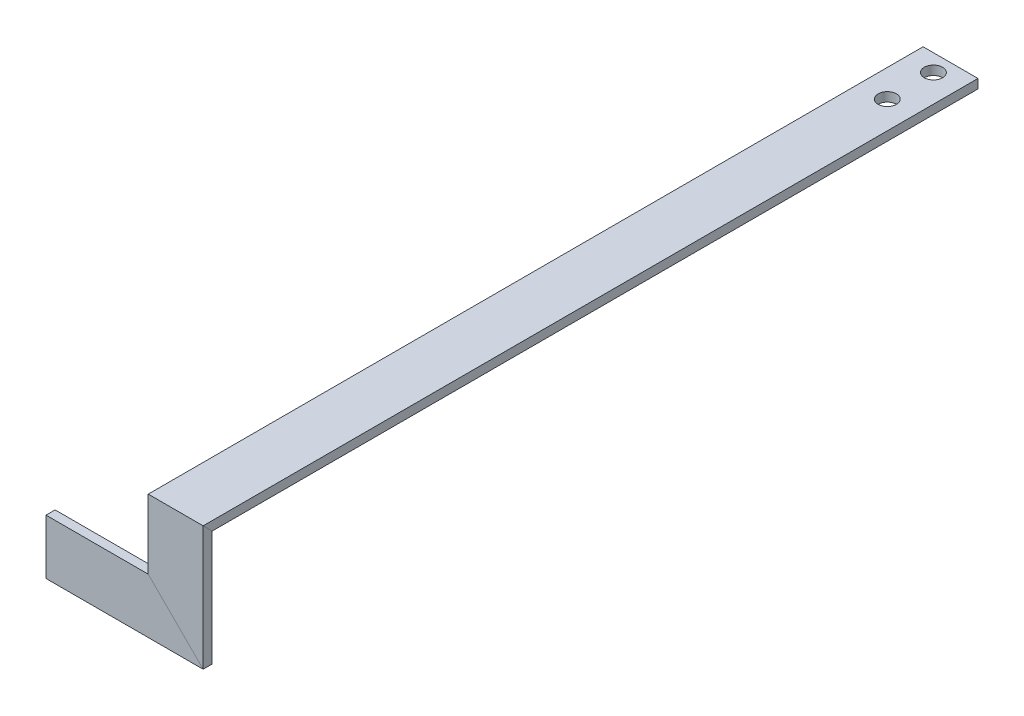
from build123d import *

# Parameters (mm, degrees)
CROQUIS1_W            = 38.1
CROQUIS1_H            = 6.31
CROQUIS2_R            = 6.35
CORTAR_EXTRUIR1_DEPTH = 6.31


with BuildPart() as part:
    # Barrer1: sweep along a curve in space
    with BuildLine() as barrer1_path:
        Line((0, 0, 0), (0, 0, 534.55))
        Line((0, 0, 534.55), (0, -64, 534.55))
        Line((0, -64, 534.55), (-90, -64, 534.55))
    # Croquis1 → Barrer1 (sweep)
    with BuildSketch(Plane.XY):
        Rectangle(CROQUIS1_W, CROQUIS1_H)
    sweep(path=barrer1_path.line, transition=Transition.RIGHT)

    # Croquis2 → Cortar-Extruir1 (cut)
    with BuildSketch(Plane(origin=(0, 3.155, 0), x_dir=(1, 0, 0), z_dir=(0, 1, 0))):
        with Locations(Location((0, -43.892204666, 0), (0, 0, 270))):
            Circle(CROQUIS2_R)
        with Locations(Location((0, -11.892204666, 0), (0, 0, 270))):
            Circle(CROQUIS2_R)
    extrude(amount=-CORTAR_EXTRUIR1_DEPTH, mode=Mode.SUBTRACT)


solid = part.part
